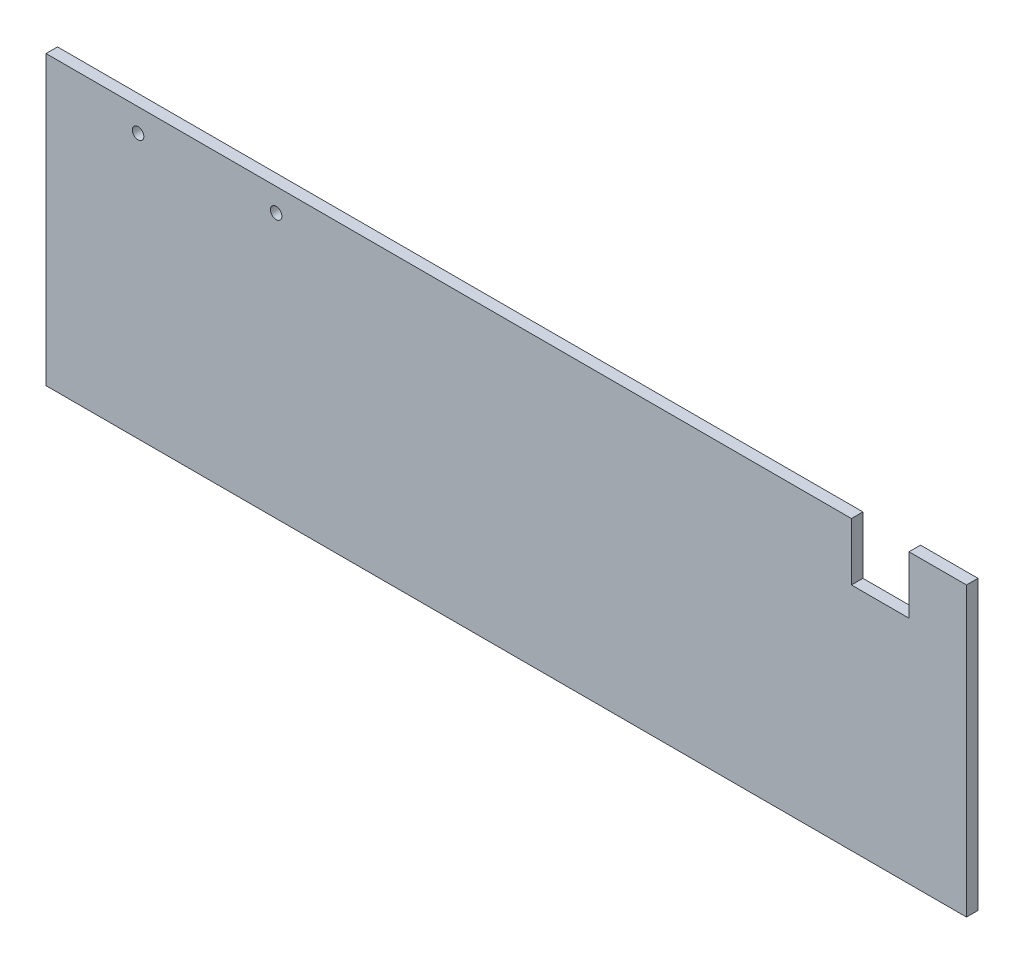
from build123d import *

# Parameters (mm, degrees)
BOSS_EXTRUDE1_DEPTH = 10
CUT_EXTRUDE1_REACH  = 421.196
SKETCH3_R           = 5


with BuildPart() as part:
    # Sketch1 → Boss-Extrude1 (new body)
    with BuildSketch(Plane.XY):
        Polygon((300, 125), (300, 75), (350, 75), (350, 125), (400, 125), (400, -125), (-400, -125), (-400, 125), align=None)
    extrude(amount=BOSS_EXTRUDE1_DEPTH)

    # Sketch3 → Cut-Extrude1 (cut, up to next)
    with BuildSketch(Plane.XY.offset(10), mode=Mode.PRIVATE) as cut_extrude1_sk1:
        with Locations((-200, 105)):
            Circle(SKETCH3_R)
    cut_extrude1_tool1 = extrude(cut_extrude1_sk1.sketch, amount=-CUT_EXTRUDE1_REACH, mode=Mode.PRIVATE) & part.part
    # Sketch3 → Cut-Extrude1 (cut, up to next)
    with BuildSketch(Plane.XY.offset(10), mode=Mode.PRIVATE) as cut_extrude1_sk2:
        with Locations(Location((-320, 105, 0), (0, 0, 180))):
            Circle(SKETCH3_R)
    cut_extrude1_tool2 = extrude(cut_extrude1_sk2.sketch, amount=-CUT_EXTRUDE1_REACH, mode=Mode.PRIVATE) & part.part
    add(cut_extrude1_tool1.solids().sort_by_distance((-200, 105, 10))[0], mode=Mode.SUBTRACT)
    add(cut_extrude1_tool2.solids().sort_by_distance((-320, 105, 10))[0], mode=Mode.SUBTRACT)


solid = part.part
